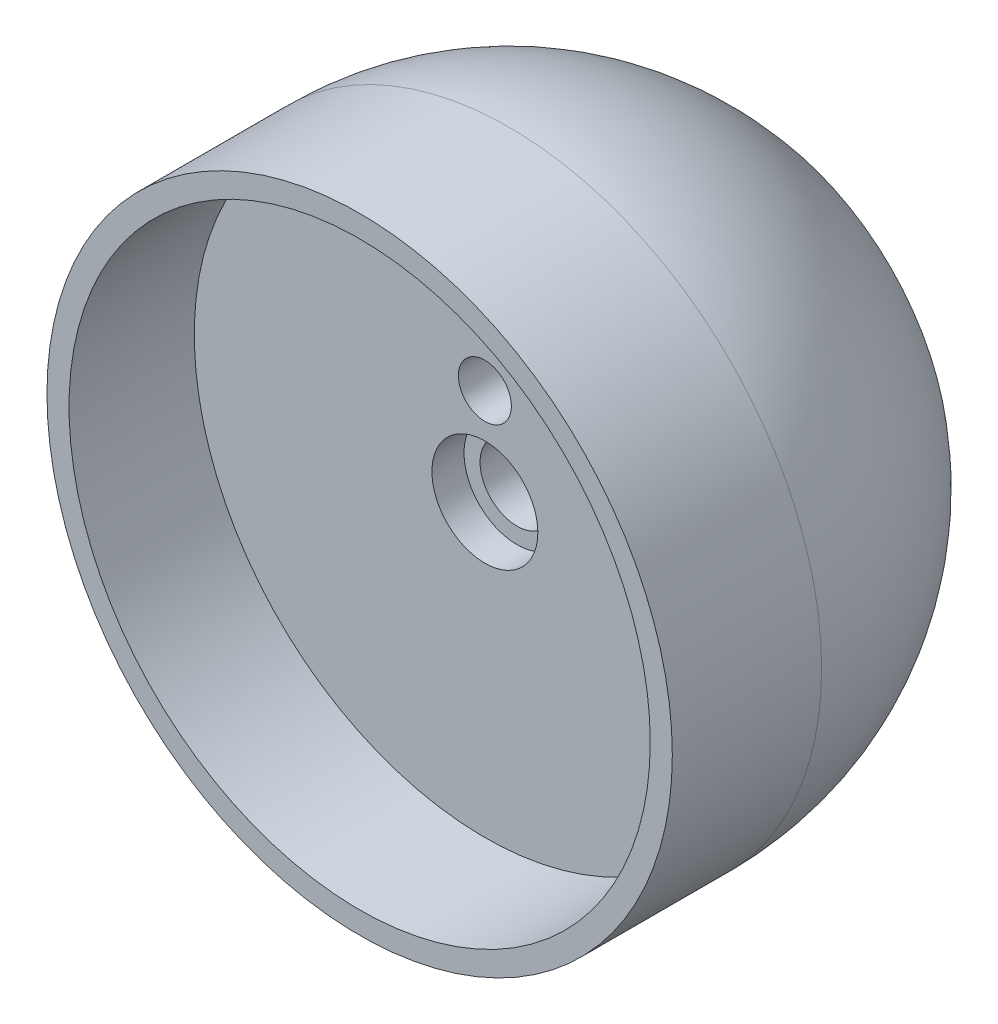
from build123d import *

# Parameters (mm, degrees)
SKETCH1_R               = 49.4665
BOSS_EXTRUDE1_DEPTH     = 23.622
SKETCH2_R               = 45.974
CUT_EXTRUDE2_DEPTH      = 19.812
CUT_EXTRUDE3_DEPTH      = 86.678491273
CUT_EXTRUDE3_DEPTH_BACK = 86.678491273
SKETCH4_W               = 76.2
SKETCH4_H               = 76.2
SKETCH5_R               = 8.382
CUT_EXTRUDE4_DEPTH      = 5.08
SKETCH6_R               = 5.842
CUT_EXTRUDE5_DEPTH      = 80.058953601
SKETCH7_R               = 4.191
CUT_EXTRUDE6_DEPTH      = 82.549477892


with BuildPart() as part:
    # Sketch1 → Boss-Extrude1 (new body)
    with BuildSketch(Plane.XY):
        Circle(SKETCH1_R)
    extrude(amount=BOSS_EXTRUDE1_DEPTH)

    # Sketch2 → Cut-Extrude2 (cut)
    with BuildSketch(Plane.XY.offset(23.622)):
        Circle(SKETCH2_R)
    extrude(amount=-CUT_EXTRUDE2_DEPTH, mode=Mode.SUBTRACT)

    # Sketch3 → Revolve1 (revolve)
    with BuildSketch(Plane(origin=(0, 0, 0), x_dir=(1, 0, 0), z_dir=(0, 1, 0)), mode=Mode.PRIVATE) as revolve1_sk:
        with BuildLine():
            Line((0, 0), (-49.4665, 0))
            ThreePointArc((-49.4665, 0), (-34.978097592, 34.978097592), (0, 49.4665))
            Line((0, 49.4665), (0, 0))
        make_face()
    revolve(revolve1_sk.sketch.rotate(Axis((0, 0, 0), (0, 0, -1)), 180), axis=Axis((0, 0, 0), (0, 0, -1)))

    # Sketch4 → Cut-Extrude3 (cut, two sides: drawn at the far end of the back side and taken through both)
    with BuildSketch(Plane(origin=(0, 0, 0), x_dir=(1, 0, 0), z_dir=(0, 1, 0)).offset(-CUT_EXTRUDE3_DEPTH_BACK)):
        with Locations((6.55123422, 76.2)):
            Rectangle(SKETCH4_W, SKETCH4_H)
    extrude(amount=CUT_EXTRUDE3_DEPTH + CUT_EXTRUDE3_DEPTH_BACK, mode=Mode.SUBTRACT)

    # Sketch5 → Cut-Extrude4 (cut)
    with BuildSketch(Plane.XY.offset(3.81)):
        Circle(SKETCH5_R)
    cut_extrude4 = extrude(amount=-CUT_EXTRUDE4_DEPTH, mode=Mode.SUBTRACT)

    # Sketch6 → Cut-Extrude5 (cut, through all)
    with BuildSketch(Plane.XY.offset(-1.27)):
        Circle(SKETCH6_R)
    extrude(amount=-CUT_EXTRUDE5_DEPTH, mode=Mode.SUBTRACT)

    # Sketch7 → Cut-Extrude6 (cut, through all)
    with BuildSketch(Plane.XY.offset(3.81)):
        with Locations((0, 15.24)):
            Circle(SKETCH7_R)
    extrude(amount=-CUT_EXTRUDE6_DEPTH, mode=Mode.SUBTRACT)

    # Mirror1: Cut-Extrude4 across plane
    add(cut_extrude4.mirror(Plane.XY.offset(-17.145)), mode=Mode.SUBTRACT)


solid = part.part
